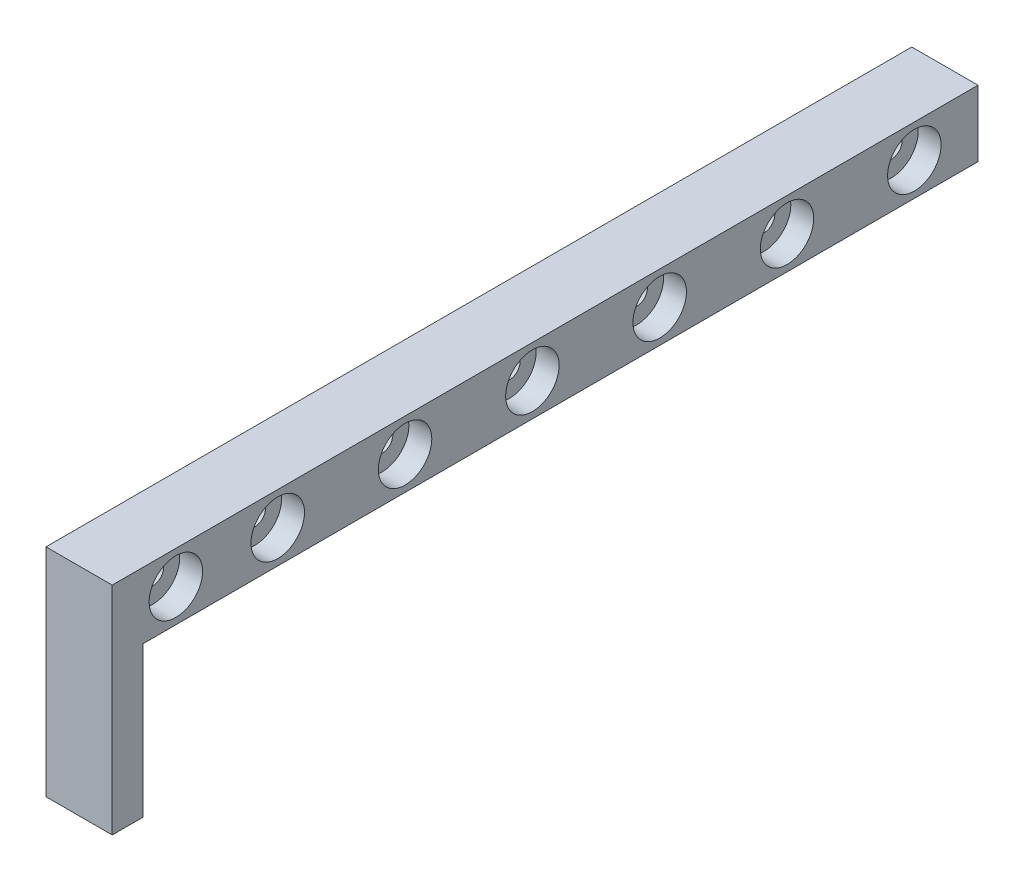
from build123d import *

# Parameters (mm, degrees)
SKETCH1_W           = 13
SKETCH1_H           = 13
BOSS_EXTRUDE1_DEPTH = 85
SKETCH2_W           = 13
SKETCH2_H           = 30.5
BOSS_EXTRUDE2_DEPTH = 3
SKETCH3_R           = 2.1
CUT_EXTRUDE1_DEPTH  = 11.5
SKETCH4_R           = 5.25
CUT_EXTRUDE2_DEPTH  = 4.5


with BuildPart() as part:
    # Sketch1 → Boss-Extrude1 (new, symmetric)
    with BuildSketch(Plane.XY):
        Rectangle(SKETCH1_W, SKETCH1_H)
    extrude(amount=BOSS_EXTRUDE1_DEPTH, both=True)

    # Sketch2 → Boss-Extrude2 (add, symmetric)
    with BuildSketch(Plane.XY.offset(82)):
        with Locations((0, -20.75)):
            Rectangle(SKETCH2_W, SKETCH2_H)
    extrude(amount=BOSS_EXTRUDE2_DEPTH, both=True)

    # Sketch3 → Cut-Extrude1 (cut, symmetric)
    with BuildSketch(Plane(origin=(0, 0, 0), x_dir=(0, 0, -1), z_dir=(1, 0, 0))):
        with Locations((72.5, 0)):
            Circle(SKETCH3_R)
        with Locations((47.5, 0)):
            Circle(SKETCH3_R)
        with Locations((22.5, 0)):
            Circle(SKETCH3_R)
        with Locations((-2.5, 0)):
            Circle(SKETCH3_R)
        with Locations((-27.5, 0)):
            Circle(SKETCH3_R)
        with Locations((-52.5, 0)):
            Circle(SKETCH3_R)
        with Locations((-72.5, 0)):
            Circle(SKETCH3_R)
    extrude(amount=CUT_EXTRUDE1_DEPTH, both=True, mode=Mode.SUBTRACT)

    # Sketch4 → Cut-Extrude2 (cut, symmetric)
    with BuildSketch(Plane(origin=(6.5, 0, 0), x_dir=(0, 0, -1), z_dir=(1, 0, 0))):
        with Locations((72.5, 0)):
            Circle(SKETCH4_R)
        with Locations((47.5, 0)):
            Circle(SKETCH4_R)
        with Locations((22.5, 0)):
            Circle(SKETCH4_R)
        with Locations((-2.5, 0)):
            Circle(SKETCH4_R)
        with Locations((-27.5, 0)):
            Circle(SKETCH4_R)
        with Locations((-52.5, 0)):
            Circle(SKETCH4_R)
        with Locations((-72.5, 0)):
            Circle(SKETCH4_R)
    extrude(amount=CUT_EXTRUDE2_DEPTH, both=True, mode=Mode.SUBTRACT)


solid = part.part
